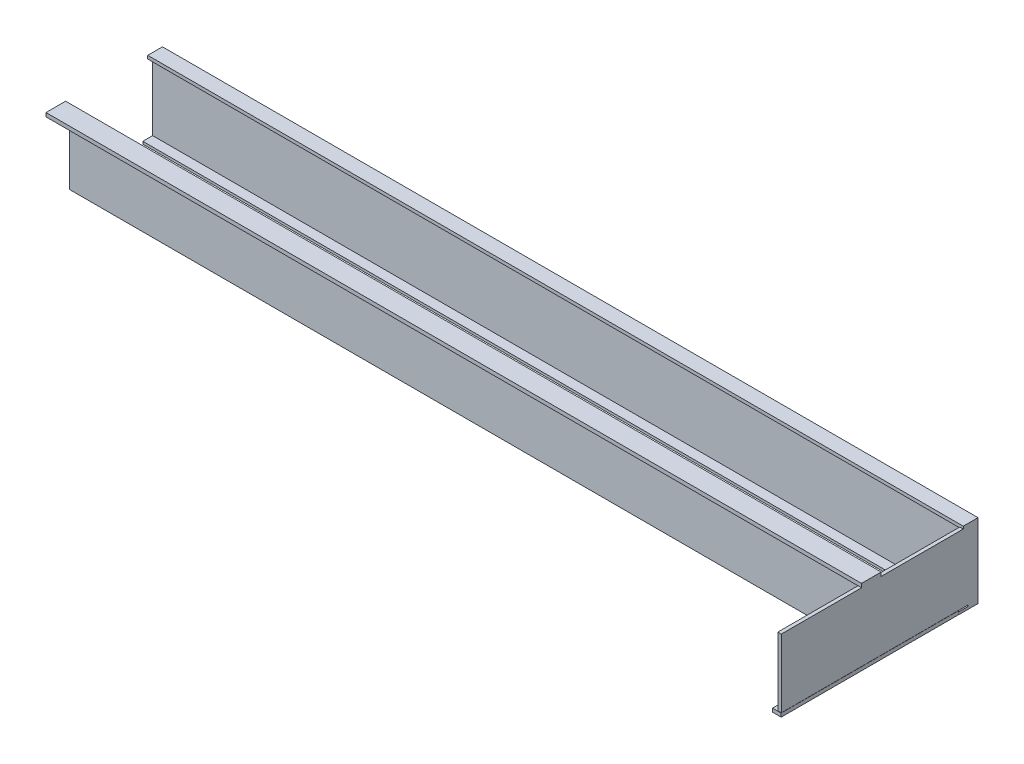
from build123d import *

# Parameters (mm, degrees)
SKETCH_1_W          = 830
SKETCH_1_H          = 82.91
EXTRUDE_2_DEPTH     = 20
SKETCH_4_W          = 830
SKETCH_4_H          = 10
CUT_EXTRUDE_3_DEPTH = 70
SKETCH_5_W          = 830
SKETCH_5_H          = 15
EXTRUDE_3_DEPTH     = 3.28
SKETCH_6_W          = 3.54
SKETCH_6_H          = 69.4
EXTRUDE_5_DEPTH     = 200.2
SKETCH_8_W          = 20
SKETCH_8_H          = 10.39973114
CUT_EXTRUDE_5_DEPTH = 1000.2
SKETCH_9_W          = 8.730890719
SKETCH_9_H          = 180.752173936
EXTRUDE_6_DEPTH     = 3.62
SKETCH_10_W         = 3.09
SKETCH_10_H         = 69.4
EXTRUDE_7_DEPTH     = 820
SKETCH_13_W         = 830
SKETCH_13_H         = 20
EXTRUDE_18_DEPTH    = 3.85


with BuildPart() as part:
    # 草图1 → 凸台-拉伸2 (new body)
    with BuildSketch(Plane.XY):
        with Locations((337.654216889, 6.096927721)):
            Rectangle(SKETCH_1_W, SKETCH_1_H)
    extrude(amount=EXTRUDE_2_DEPTH)

    # 草图4 → 切除-拉伸3 (cut)
    with BuildSketch(Plane(origin=(0, 47.551927721, 0), x_dir=(1, 0, 0), z_dir=(0, 1, 0))):
        with Locations((337.654216889, -15)):
            Rectangle(SKETCH_4_W, SKETCH_4_H)
    extrude(amount=-CUT_EXTRUDE_3_DEPTH, mode=Mode.SUBTRACT)

    # 草图5 → 凸台-拉伸3 (add)
    with BuildSketch(Plane(origin=(0, 47.551927721, 0), x_dir=(1, 0, 0), z_dir=(0, 1, 0))):
        with Locations((337.654216889, -7.5)):
            Rectangle(SKETCH_5_W, SKETCH_5_H)
    extrude(amount=EXTRUDE_3_DEPTH)

    # 草图6 → 凸台-拉伸5 (add)
    with BuildSketch(Plane(origin=(752.654216889, 50.831927721, 0), x_dir=(-1, 0, 0), z_dir=(0, 0, -1))):
        with Locations((1.77, -37.215224989)):
            Rectangle(SKETCH_6_W, SKETCH_6_H)
    extrude(amount=-EXTRUDE_5_DEPTH)

    # 草图8 → 切除-拉伸5 (cut)
    with BuildSketch(Plane.ZY.offset(77.345783111)):
        with Locations((10, -30.158206709)):
            Rectangle(SKETCH_8_W, SKETCH_8_H)
    extrude(amount=-CUT_EXTRUDE_5_DEPTH, mode=Mode.SUBTRACT)

    # 草图9 → 凸台-拉伸6 (add)
    with BuildSketch(Plane.XZ.offset(21.083297268)):
        with Locations((748.455599967, 110.153891103)):
            Rectangle(SKETCH_9_W, SKETCH_9_H)
    extrude(amount=EXTRUDE_6_DEPTH)

    # 草图10 → 凸台-拉伸7 (add)
    with BuildSketch(Plane.ZY.offset(-749.114216889)):
        with Locations((99.616509489, 13.616702732)):
            Rectangle(SKETCH_10_W, SKETCH_10_H)
    extrude(amount=EXTRUDE_7_DEPTH)

    # 草图13 → 凸台-拉伸18 (add)
    with BuildSketch(Plane(origin=(0, 48.316702732, 0), x_dir=(1, 0, 0), z_dir=(0, 1, 0))):
        with Locations((337.654216889, -108.539027645)):
            Rectangle(SKETCH_13_W, SKETCH_13_H)
    extrude(amount=EXTRUDE_18_DEPTH)


solid = part.part
